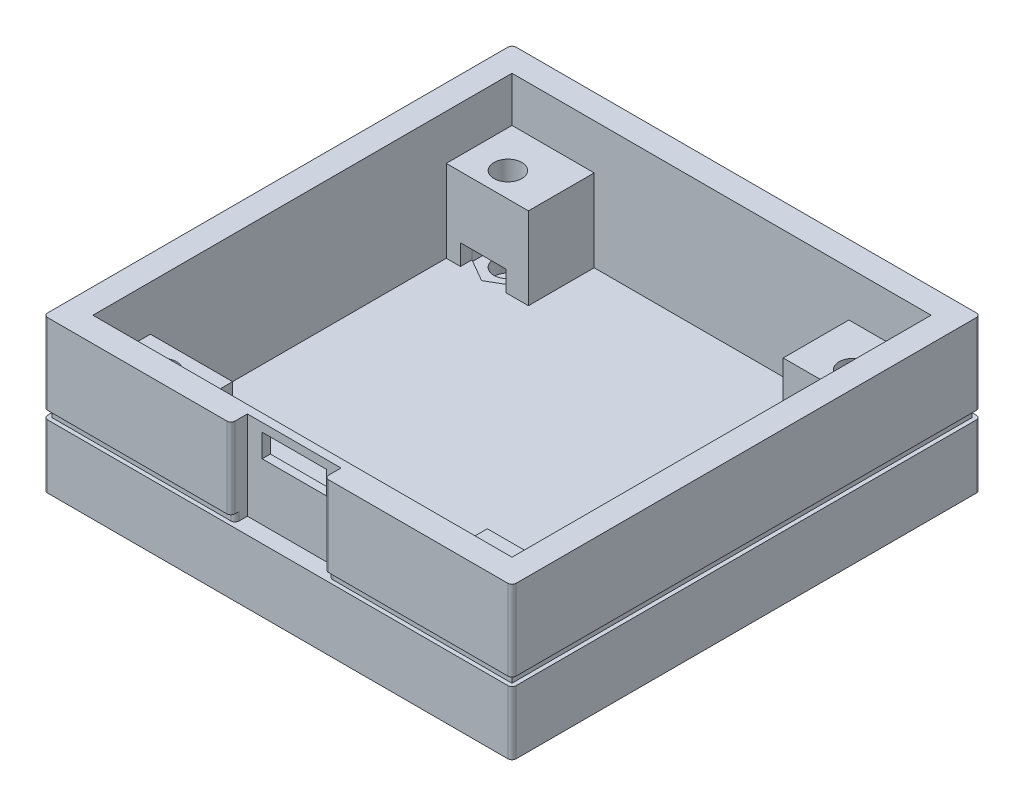
from build123d import *

# Parameters (mm, degrees)
ESQUISSE1_W              = 57
ESQUISSE1_H              = 57
BOSS_EXTRU_1_DEPTH       = 18.5
ESQUISSE2_W              = 51
ESQUISSE2_H              = 51
ENL_V_MAT_EXTRU_1_DEPTH  = 15.5
ESQUISSE4_W              = 10
ESQUISSE4_H              = 8
BOSS_EXTRU_2_DEPTH       = 10
ESQUISSE5_W              = 10
ESQUISSE5_H              = 8
BOSS_EXTRU_3_DEPTH       = 10
ESQUISSE6_W              = 10
ESQUISSE6_H              = 7
BOSS_EXTRU_4_DEPTH       = 10
ESQUISSE7_W              = 10
ESQUISSE7_H              = 7
BOSS_EXTRU_5_DEPTH       = 10
ESQUISSE8_R              = 1.7
ENL_V_MAT_EXTRU_2_DEPTH  = 12
ESQUISSE9_R              = 1.7
ENL_V_MAT_EXTRU_3_DEPTH  = 12
ESQUISSE16_R             = 1.7
ENL_V_MAT_EXTRU_9_DEPTH  = 12
ESQUISSE17_R             = 1.7
ENL_V_MAT_EXTRU_10_DEPTH = 12
ESQUISSE21_W             = 7.8
ESQUISSE21_H             = 2.8
ENL_V_MAT_EXTRU_14_DEPTH = 3
ENL_V_START              = -7.5
ENL_V_MAT_EXTRU_18_DEPTH = 2.7
ENL_V_MAT_EXTRU_20_DEPTH = 2.7
ESQUISSE26_W             = 5.54
ESQUISSE26_H             = 2.5
ENL_V_MAT_EXTRU_21_DEPTH = 2.847955181
ENL_V_MAT_EXTRU_22_DEPTH = 2.7
ENL_V_MAT_EXTRU_24_DEPTH = 2.7
ESQUISSE23_W             = 5.54
ESQUISSE23_H             = 2.5
ENL_V_MAT_EXTRU_26_DEPTH = 2
ESQUISSE31_W             = 5.54
ESQUISSE31_H             = 2.5
ENL_V_MAT_EXTRU_27_DEPTH = 2
ESQUISSE30_W             = 5.54
ESQUISSE30_H             = 2.5
ENL_V_MAT_EXTRU_28_DEPTH = 2
ESQUISSE32_W             = 57
ESQUISSE32_H             = 1
ENL_V_MAT_EXTRU_29_DEPTH = 0.5
ESQUISSE33_W             = 57
ESQUISSE33_H             = 1
ENL_V_MAT_EXTRU_30_DEPTH = 0.5
ESQUISSE34_W             = 57
ESQUISSE34_H             = 1
ENL_V_MAT_EXTRU_31_DEPTH = 0.5
ESQUISSE35_W             = 57
ESQUISSE35_H             = 1
ENL_V_MAT_EXTRU_32_DEPTH = 0.5
ESQUISSE36_W             = 11.4
ESQUISSE36_H             = 10.780005484
ENL_V_MAT_EXTRU_33_DEPTH = 2
CONG_1_R                 = 0.5
CONG_2_R                 = 0.5
CONG_3_R                 = 0.5
CONG_4_R                 = 0.5
CONG_5_R                 = 0.5
CONG_6_R                 = 0.5
CONG_7_R                 = 0.5
CONG_8_R                 = 0.5
CONG_9_R                 = 0.5
CONG_10_R                = 0.5
CONG_11_R                = 0.5
CONG_12_R                = 0.5


with BuildPart() as part:
    # Esquisse1 → Boss.-Extru.1 (new body)
    with BuildSketch(Plane(origin=(0, 0, 0), x_dir=(1, 0, 0), z_dir=(0, 1, 0))):
        with Locations((-1.510072399, 8.394175698)):
            Rectangle(ESQUISSE1_W, ESQUISSE1_H)
    extrude(amount=BOSS_EXTRU_1_DEPTH)

    # Esquisse2 → Enlèv. mat.-Extru.1 (cut)
    with BuildSketch(Plane(origin=(0, 18.5, 0), x_dir=(1, 0, 0), z_dir=(0, 1, 0))):
        with Locations((-1.510072399, 8.394175698)):
            Rectangle(ESQUISSE2_W, ESQUISSE2_H)
    extrude(amount=-ENL_V_MAT_EXTRU_1_DEPTH, mode=Mode.SUBTRACT)

    # Esquisse4 → Boss.-Extru.2 (add)
    with BuildSketch(Plane(origin=(0, 3, 0), x_dir=(1, 0, 0), z_dir=(0, 1, 0))):
        with Locations((-22.010072399, 29.894175698)):
            Rectangle(ESQUISSE4_W, ESQUISSE4_H)
    extrude(amount=BOSS_EXTRU_2_DEPTH)

    # Esquisse5 → Boss.-Extru.3 (add)
    with BuildSketch(Plane(origin=(0, 3, 0), x_dir=(1, 0, 0), z_dir=(0, 1, 0))):
        with Locations((18.989927601, 29.894175698)):
            Rectangle(ESQUISSE5_W, ESQUISSE5_H)
    extrude(amount=BOSS_EXTRU_3_DEPTH)

    # Esquisse6 → Boss.-Extru.4 (add)
    with BuildSketch(Plane(origin=(0, 3, 0), x_dir=(1, 0, 0), z_dir=(0, 1, 0))):
        with Locations((18.989927601, -13.605824302)):
            Rectangle(ESQUISSE6_W, ESQUISSE6_H)
    extrude(amount=BOSS_EXTRU_4_DEPTH)

    # Esquisse7 → Boss.-Extru.5 (add)
    with BuildSketch(Plane(origin=(0, 3, 0), x_dir=(1, 0, 0), z_dir=(0, 1, 0))):
        with Locations((-22.010072399, -13.605824302)):
            Rectangle(ESQUISSE7_W, ESQUISSE7_H)
    extrude(amount=BOSS_EXTRU_5_DEPTH)

    # Esquisse8 → Enlèv. mat.-Extru.2 (cut)
    with BuildSketch(Plane(origin=(0, 13, 0), x_dir=(1, 0, 0), z_dir=(0, 1, 0))):
        with Locations(Location((19.489927601, -13.105824302, 0), (0, 0, 270))):
            Circle(ESQUISSE8_R)
    extrude(amount=-ENL_V_MAT_EXTRU_2_DEPTH, mode=Mode.SUBTRACT)

    # Esquisse9 → Enlèv. mat.-Extru.3 (cut)
    with BuildSketch(Plane(origin=(0, 13, 0), x_dir=(1, 0, 0), z_dir=(0, 1, 0))):
        with Locations(Location((-22.510072399, -13.105824302, 0), (0, 0, 270))):
            Circle(ESQUISSE9_R)
    extrude(amount=-ENL_V_MAT_EXTRU_3_DEPTH, mode=Mode.SUBTRACT)

    # Esquisse16 → Enlèv. mat.-Extru.9 (cut)
    with BuildSketch(Plane(origin=(0, 13, 0), x_dir=(1, 0, 0), z_dir=(0, 1, 0))):
        with Locations(Location((-22.510072399, 28.894175698, 0), (0, 0, 270))):
            Circle(ESQUISSE16_R)
    extrude(amount=-ENL_V_MAT_EXTRU_9_DEPTH, mode=Mode.SUBTRACT)

    # Esquisse17 → Enlèv. mat.-Extru.10 (cut)
    with BuildSketch(Plane(origin=(0, 13, 0), x_dir=(1, 0, 0), z_dir=(0, 1, 0))):
        with Locations(Location((19.489927601, 28.894175698, 0), (0, 0, 270))):
            Circle(ESQUISSE17_R)
    extrude(amount=-ENL_V_MAT_EXTRU_10_DEPTH, mode=Mode.SUBTRACT)

    # Esquisse21 → Enlèv. mat.-Extru.14 (cut)
    with BuildSketch(Plane.XY.offset(20.105824302)):
        with Locations((-1.510072399, 16.07)):
            Rectangle(ESQUISSE21_W, ESQUISSE21_H)
    extrude(amount=-ENL_V_MAT_EXTRU_14_DEPTH, mode=Mode.SUBTRACT)

    # Esquisse24 → Enlèv. mat.-Extru.18 (cut)
    with BuildSketch(Plane(origin=(0, 13, 0), x_dir=(1, 0, 0), z_dir=(0, 1, 0)).offset(ENL_V_START)):
        Polygon((19.489927601, 25.694175698), (22.261208893, 27.294175698), (22.261208893, 30.494175698), (19.489927601, 32.094175698), (16.718646309, 30.494175698), (16.718646309, 27.294175698), align=None)
    extrude(amount=-ENL_V_MAT_EXTRU_18_DEPTH, mode=Mode.SUBTRACT)

    # Esquisse25 → Enlèv. mat.-Extru.20 (cut)
    with BuildSketch(Plane(origin=(0, 13, 0), x_dir=(1, 0, 0), z_dir=(0, 1, 0)).offset(ENL_V_START)):
        Polygon((16.718646309, -11.505824302), (16.718646309, -14.705824302), (19.489927601, -16.305824302), (22.261208893, -14.705824302), (22.261208893, -11.505824302), (19.489927601, -9.905824302), align=None)
    extrude(amount=-ENL_V_MAT_EXTRU_20_DEPTH, mode=Mode.SUBTRACT)

    # Esquisse26 → Enlèv. mat.-Extru.21 (cut)
    with BuildSketch(Plane(origin=(0, 0, 10.105824302), x_dir=(-1, 0, 0), z_dir=(0, 0, -1))):
        with Locations((-19.489927601, 4.25)):
            Rectangle(ESQUISSE26_W, ESQUISSE26_H)
    extrude(amount=-ENL_V_MAT_EXTRU_21_DEPTH, mode=Mode.SUBTRACT)

    # Esquisse27 → Enlèv. mat.-Extru.22 (cut)
    with BuildSketch(Plane(origin=(0, 13, 0), x_dir=(1, 0, 0), z_dir=(0, 1, 0)).offset(ENL_V_START)):
        Polygon((-19.738791107, 27.294175698), (-19.738791107, 30.494175698), (-22.510072399, 32.094175698), (-25.281353691, 30.494175698), (-25.281353691, 27.294175698), (-22.510072399, 25.694175698), align=None)
    extrude(amount=-ENL_V_MAT_EXTRU_22_DEPTH, mode=Mode.SUBTRACT)

    # Esquisse29 → Enlèv. mat.-Extru.24 (cut)
    with BuildSketch(Plane(origin=(0, 13, 0), x_dir=(1, 0, 0), z_dir=(0, 1, 0)).offset(ENL_V_START)):
        Polygon((-19.738791107, -11.505824302), (-22.510072399, -9.905824302), (-25.281353691, -11.505824302), (-25.281353691, -14.705824302), (-22.510072399, -16.305824302), (-19.738791107, -14.705824302), align=None)
    extrude(amount=-ENL_V_MAT_EXTRU_24_DEPTH, mode=Mode.SUBTRACT)

    # Esquisse23 → Enlèv. mat.-Extru.26 (cut)
    with BuildSketch(Plane.XY.offset(-25.894175698)):
        with Locations((19.489927601, 4.25)):
            Rectangle(ESQUISSE23_W, ESQUISSE23_H)
    extrude(amount=-ENL_V_MAT_EXTRU_26_DEPTH, mode=Mode.SUBTRACT)

    # Esquisse31 → Enlèv. mat.-Extru.27 (cut)
    with BuildSketch(Plane.XY.offset(-25.894175698)):
        with Locations((-22.510072399, 4.25)):
            Rectangle(ESQUISSE31_W, ESQUISSE31_H)
    extrude(amount=-ENL_V_MAT_EXTRU_27_DEPTH, mode=Mode.SUBTRACT)

    # Esquisse30 → Enlèv. mat.-Extru.28 (cut)
    with BuildSketch(Plane(origin=(0, 0, 10.105824302), x_dir=(-1, 0, 0), z_dir=(0, 0, -1))):
        with Locations((22.510072399, 4.25)):
            Rectangle(ESQUISSE30_W, ESQUISSE30_H)
    extrude(amount=-ENL_V_MAT_EXTRU_28_DEPTH, mode=Mode.SUBTRACT)

    # Esquisse32 → Enlèv. mat.-Extru.29 (cut)
    with BuildSketch(Plane.ZY.offset(30.010072399)):
        with Locations((-8.394175698, 8.219994516)):
            Rectangle(ESQUISSE32_W, ESQUISSE32_H)
    extrude(amount=-ENL_V_MAT_EXTRU_29_DEPTH, mode=Mode.SUBTRACT)

    # Esquisse33 → Enlèv. mat.-Extru.30 (cut)
    with BuildSketch(Plane.XY.offset(20.105824302)):
        with Locations((-1.510072399, 8.219994516)):
            Rectangle(ESQUISSE33_W, ESQUISSE33_H)
    extrude(amount=-ENL_V_MAT_EXTRU_30_DEPTH, mode=Mode.SUBTRACT)

    # Esquisse34 → Enlèv. mat.-Extru.31 (cut)
    with BuildSketch(Plane(origin=(26.989927601, 0, 0), x_dir=(0, 0, -1), z_dir=(1, 0, 0))):
        with Locations((8.394175698, 8.219994516)):
            Rectangle(ESQUISSE34_W, ESQUISSE34_H)
    extrude(amount=-ENL_V_MAT_EXTRU_31_DEPTH, mode=Mode.SUBTRACT)

    # Esquisse35 → Enlèv. mat.-Extru.32 (cut)
    with BuildSketch(Plane(origin=(0, 0, -36.894175698), x_dir=(-1, 0, 0), z_dir=(0, 0, -1))):
        with Locations((1.510072399, 8.219994516)):
            Rectangle(ESQUISSE35_W, ESQUISSE35_H)
    extrude(amount=-ENL_V_MAT_EXTRU_32_DEPTH, mode=Mode.SUBTRACT)

    # Esquisse36 → Enlèv. mat.-Extru.33 (cut)
    with BuildSketch(Plane.XY.offset(20.105824302)):
        with Locations((-1.510072399, 13.109997258)):
            Rectangle(ESQUISSE36_W, ESQUISSE36_H)
    extrude(amount=-ENL_V_MAT_EXTRU_33_DEPTH, mode=Mode.SUBTRACT)

    # Congé1
    cong_1_edges = [part.edges().sort_by_distance(p)[0] for p in [
        (-7.210072399, 13.609997258, 20.105824302),
    ]]
    fillet(cong_1_edges, radius=CONG_1_R)

    # Congé2
    cong_2_edges = [part.edges().sort_by_distance(p)[0] for p in [
        (4.189927601, 13.609997258, 20.105824302),
    ]]
    fillet(cong_2_edges, radius=CONG_2_R)

    # Congé3
    cong_3_edges = [part.edges().sort_by_distance(p)[0] for p in [
        (-7.210072399, 8.219994516, 19.605824302),
    ]]
    fillet(cong_3_edges, radius=CONG_3_R)

    # Congé4
    cong_4_edges = [part.edges().sort_by_distance(p)[0] for p in [
        (4.189927601, 8.219994516, 19.605824302),
    ]]
    fillet(cong_4_edges, radius=CONG_4_R)

    # Congé5
    cong_5_edges = [part.edges().sort_by_distance(p)[0] for p in [
        (26.989927601, 13.609997258, 20.105824302),
    ]]
    fillet(cong_5_edges, radius=CONG_5_R)

    # Congé6
    cong_6_edges = [part.edges().sort_by_distance(p)[0] for p in [
        (26.989927601, 3.859997258, 20.105824302),
    ]]
    fillet(cong_6_edges, radius=CONG_6_R)

    # Congé7
    cong_7_edges = [part.edges().sort_by_distance(p)[0] for p in [
        (26.989927601, 13.609997258, -36.894175698),
    ]]
    fillet(cong_7_edges, radius=CONG_7_R)

    # Congé8
    cong_8_edges = [part.edges().sort_by_distance(p)[0] for p in [
        (26.989927601, 3.859997258, -36.894175698),
    ]]
    fillet(cong_8_edges, radius=CONG_8_R)

    # Congé9
    cong_9_edges = [part.edges().sort_by_distance(p)[0] for p in [
        (-30.010072399, 13.609997258, -36.894175698),
    ]]
    fillet(cong_9_edges, radius=CONG_9_R)

    # Congé10
    cong_10_edges = [part.edges().sort_by_distance(p)[0] for p in [
        (-30.010072399, 3.859997258, -36.894175698),
    ]]
    fillet(cong_10_edges, radius=CONG_10_R)

    # Congé11
    cong_11_edges = [part.edges().sort_by_distance(p)[0] for p in [
        (-30.010072399, 13.609997258, 20.105824302),
    ]]
    fillet(cong_11_edges, radius=CONG_11_R)

    # Congé12
    cong_12_edges = [part.edges().sort_by_distance(p)[0] for p in [
        (-30.010072399, 3.859997258, 20.105824302),
    ]]
    fillet(cong_12_edges, radius=CONG_12_R)


solid = part.part
